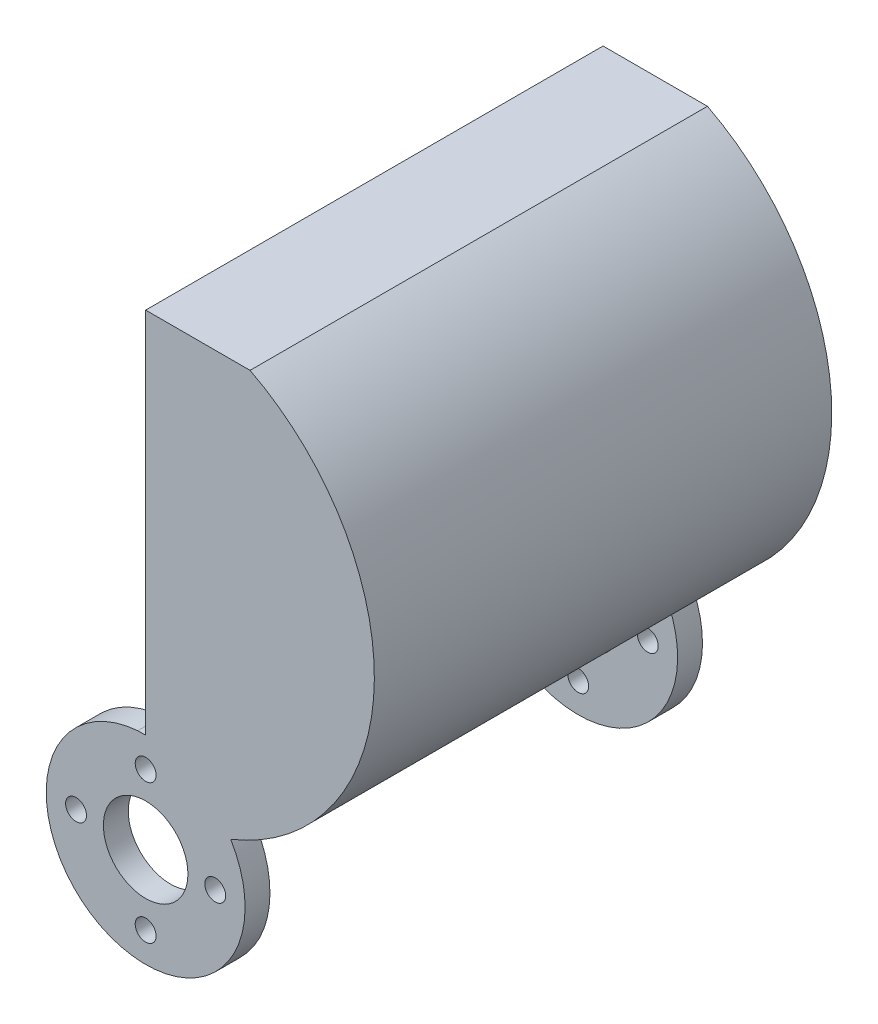
from build123d import *

# Parameters (mm, degrees)
SKETCH1_R           = 4.25
SKETCH1_R_2         = 1.05
BOSS_EXTRUDE1_DEPTH = 23
BOSS_EXTRUDE3_DEPTH = 2
SKETCH4_W           = 21
SKETCH4_H           = 41
CUT_EXTRUDE1_DEPTH  = 50.288548817
BOSS_EXTRUDE4_START = 42
BOSS_EXTRUDE4_DEPTH = 42


with BuildPart() as part:
    # Sketch1 → Boss-Extrude1 (new, symmetric)
    with BuildSketch(Plane.XY):
        with BuildLine():
            Line((-0.798015115, 9.968107738), (11.201984885, 9.968107738))
            ThreePointArc((11.201984885, 9.968107738), (19.90012903, 28.53283063), (7.687881875, 45))
            Line((7.687881875, 45), (3.464101615, 45))
            Line((3.464101615, 45), (0, 47))
            Line((0, 47), (10.5, 47))
            ThreePointArc((10.5, 47), (22.975048867, 25.465576737), (8.550692083, 5.18513885))
            ThreePointArc((8.550692083, 5.18513885), (-4.554689659, -8.902516617), (-0.798015115, 9.968107738))
        make_face()
        Circle(SKETCH1_R, mode=Mode.SUBTRACT)
        with Locations((0, 7)):
            Circle(SKETCH1_R_2, mode=Mode.SUBTRACT)
        with Locations((7, 0)):
            Circle(SKETCH1_R_2, mode=Mode.SUBTRACT)
        with Locations((0, -7)):
            Circle(SKETCH1_R_2, mode=Mode.SUBTRACT)
        with Locations((-7, 0)):
            Circle(SKETCH1_R_2, mode=Mode.SUBTRACT)
    extrude(amount=BOSS_EXTRUDE1_DEPTH, both=True)

    # Sketch3 → Boss-Extrude3 (add)
    with BuildSketch(Plane.XY.offset(23)):
        with BuildLine():
            Line((0, 47), (3.464101615, 45))
            Line((3.464101615, 45), (7.687881875, 45))
            ThreePointArc((7.687881875, 45), (19.90012903, 28.53283063), (11.201984885, 9.968107738))
            Line((11.201984885, 9.968107738), (0, 9.968107738))
            Line((0, 9.968107738), (0, 47))
        make_face()
    boss_extrude3 = extrude(amount=-BOSS_EXTRUDE3_DEPTH)

    # Mirror1: Boss-Extrude3 across plane
    add(boss_extrude3.mirror(Plane.XY))

    # Sketch4 → Cut-Extrude1 (cut, through all)
    with BuildSketch(Plane(origin=(0, 9.968107738, 0), x_dir=(1, 0, 0), z_dir=(0, 1, 0))):
        Rectangle(SKETCH4_W, SKETCH4_H)
    extrude(amount=-CUT_EXTRUDE1_DEPTH, mode=Mode.SUBTRACT)

    # Sketch6 → Boss-Extrude4 (add)
    with BuildSketch(Plane.XY.offset(-21).offset(BOSS_EXTRUDE4_START)):
        with BuildLine():
            Line((0, 22.833916422), (19.654261637, 22.833916422))
            ThreePointArc((19.654261637, 22.833916422), (19.326374482, 21.389653004), (18.892510823, 19.973613057))
            Line((18.892510823, 19.973613057), (0, 19.973613057))
            Line((0, 19.973613057), (0, 22.833916422))
        make_face()
    extrude(amount=-BOSS_EXTRUDE4_DEPTH)


solid = part.part
